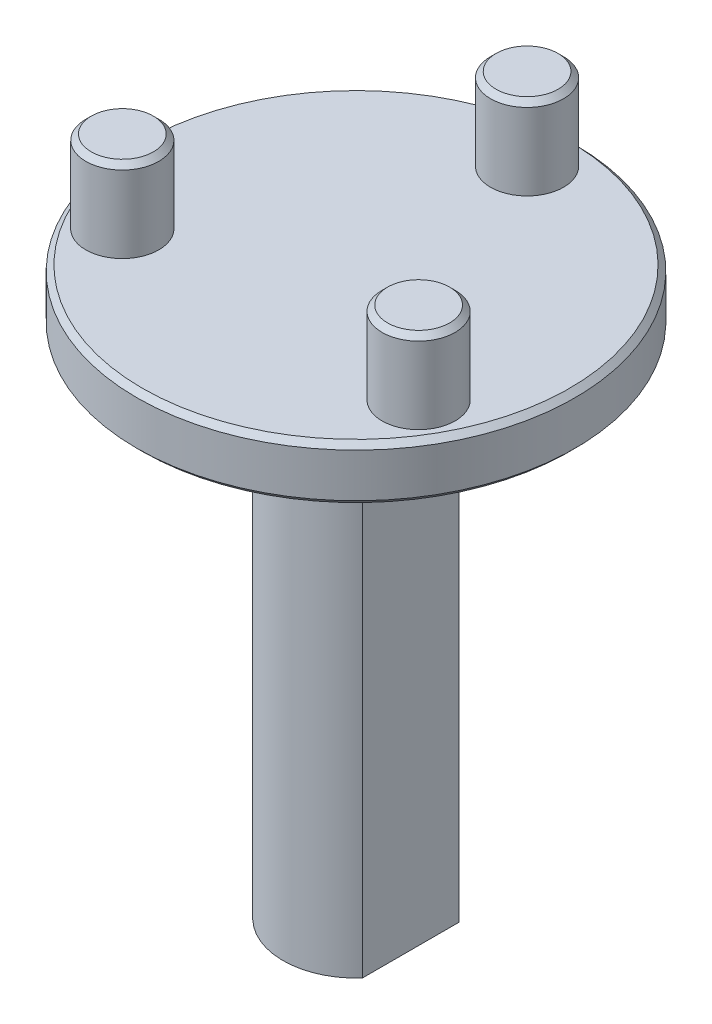
from build123d import *

# Parameters (mm, degrees)
SKETCH1_R           = 12
BOSS_EXTRUDE1_DEPTH = 3
SKETCH2_R           = 2
BOSS_EXTRUDE2_DEPTH = 4.5
SKETCH3_R           = 5
BOSS_EXTRUDE3_DEPTH = 1
BOSS_EXTRUDE4_DEPTH = 27
CHAMFER1_SIZE       = 0.3


with BuildPart() as part:
    # Sketch1 → Boss-Extrude1 (new body)
    with BuildSketch(Plane(origin=(0, 0, 0), x_dir=(1, 0, 0), z_dir=(0, 1, 0))):
        with Locations(Location((0, 0, 0), (0, 0, 270))):
            Circle(SKETCH1_R)
    extrude(amount=BOSS_EXTRUDE1_DEPTH)

    # Sketch2 → Boss-Extrude2 (add)
    with BuildSketch(Plane(origin=(0, 3, 0), x_dir=(1, 0, 0), z_dir=(0, 1, 0))):
        with Locations(Location((0, 9.37, 0), (0, 0, 270))):
            Circle(SKETCH2_R)
        with Locations(Location((-8.114658033, -4.685, 0), (0, 0, 270))):
            Circle(SKETCH2_R)
        with Locations(Location((8.114658033, -4.685, 0), (0, 0, 270))):
            Circle(SKETCH2_R)
    extrude(amount=BOSS_EXTRUDE2_DEPTH)

    # Sketch3 → Boss-Extrude3 (add)
    with BuildSketch(Plane.XZ):
        with Locations(Location((0, 0, 0), (0, 0, 270))):
            Circle(SKETCH3_R)
    extrude(amount=BOSS_EXTRUDE3_DEPTH)

    # Sketch4 → Boss-Extrude4 (add)
    with BuildSketch(Plane.XZ.offset(1)):
        with BuildLine():
            Line((3, 2.645751311), (3, -2.645751311))
            ThreePointArc((3, -2.645751311), (-4, 0), (3, 2.645751311))
        make_face()
    extrude(amount=BOSS_EXTRUDE4_DEPTH)

    # Chamfer1
    chamfer1_edges = [part.edges().sort_by_distance(p)[0] for p in [
        (-8.114658033, 7.5, 2.685),
        (8.114658033, 7.5, 2.685),
        (0, 0, -12),
        (0, 3, -12),
        (0, 7.5, -11.37),
    ]]
    chamfer(chamfer1_edges, length=CHAMFER1_SIZE)


solid = part.part
